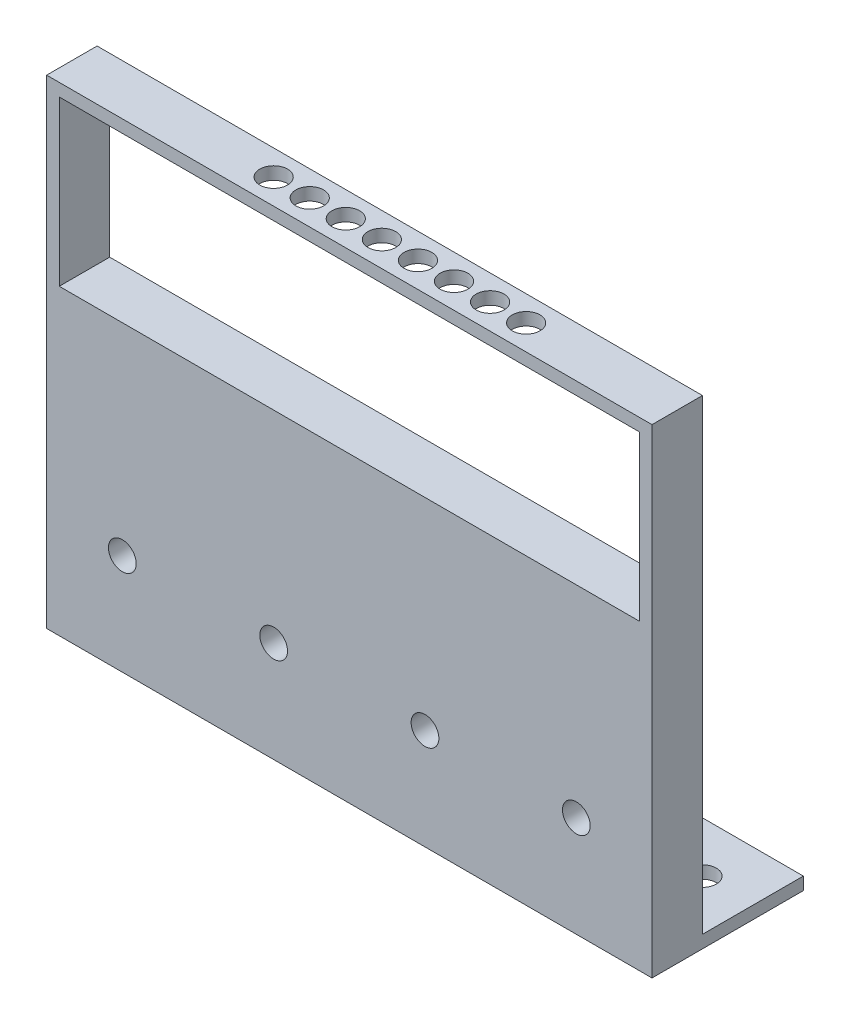
from build123d import *

# Parameters (mm, degrees)
SKETCH1_W               = 152.4
SKETCH1_H               = 12.7
BOSS_EXTRUDE1_DEPTH     = 76.2
SKETCH2_R               = 3.4925
BOSS_EXTRUDE4_DEPTH     = 3.175
BOSS_EXTRUDE5_DEPTH     = 12.7
CUT_EXTRUDE1_REACH      = 148.188
SKETCH4_R               = 3.4925
CUT_EXTRUDE2_DEPTH      = 147.187978302
CUT_EXTRUDE2_DEPTH_BACK = 147.187978302
SKETCH5_R               = 3.4925


with BuildPart() as part:
    # Sketch1 → Boss-Extrude1 (new body)
    with BuildSketch(Plane(origin=(0, 0, 0), x_dir=(1, 0, 0), z_dir=(0, 1, 0))):
        Rectangle(SKETCH1_W, SKETCH1_H)
    extrude(amount=BOSS_EXTRUDE1_DEPTH)

    # Sketch2 → Boss-Extrude4 (add)
    with BuildSketch(Plane(origin=(0, 0, 0), x_dir=(1, 0, 0), z_dir=(0, 1, 0))):
        Polygon((-76.2, 19.05), (-76.2, 6.35), (76.2, 6.35), (76.2, 31.75), (-76.2, 31.75), align=None)
        with Locations(Location((-63.5, 19.05, 0), (0, 0, 270))):
            Circle(SKETCH2_R, mode=Mode.SUBTRACT)
        with Locations(Location((-38.1, 19.05, 0), (0, 0, 270))):
            Circle(SKETCH2_R, mode=Mode.SUBTRACT)
        with Locations(Location((-12.7, 19.05, 0), (0, 0, 270))):
            Circle(SKETCH2_R, mode=Mode.SUBTRACT)
        with Locations(Location((12.7, 19.05, 0), (0, 0, 270))):
            Circle(SKETCH2_R, mode=Mode.SUBTRACT)
        with Locations(Location((38.1, 19.05, 0), (0, 0, 270))):
            Circle(SKETCH2_R, mode=Mode.SUBTRACT)
        with Locations(Location((63.5, 19.05, 0), (0, 0, 270))):
            Circle(SKETCH2_R, mode=Mode.SUBTRACT)
    extrude(amount=BOSS_EXTRUDE4_DEPTH)

    # Sketch3 → Boss-Extrude5 (add)
    with BuildSketch(Plane.XY.offset(6.35)):
        Polygon((-76.2, 76.2), (-76.2, 120.65), (76.2, 120.65), (76.2, 76.2), (73.025, 76.2), (73.025, 117.475), (-73.025, 117.475), (-73.025, 76.2), align=None)
    extrude(amount=-BOSS_EXTRUDE5_DEPTH)

    # Sketch4 → Cut-Extrude1 (cut, up to next)
    with BuildSketch(Plane(origin=(0, 120.65, 0), x_dir=(1, 0, 0), z_dir=(0, 1, 0)), mode=Mode.PRIVATE) as cut_extrude1_sk1:
        with Locations(Location((-25.4, 0, 0), (0, 0, 270))):
            Circle(SKETCH4_R)
    cut_extrude1_tool1 = extrude(cut_extrude1_sk1.sketch, amount=-CUT_EXTRUDE1_REACH, mode=Mode.PRIVATE) & part.part
    # Sketch4 → Cut-Extrude1 (cut, up to next)
    with BuildSketch(Plane(origin=(0, 120.65, 0), x_dir=(1, 0, 0), z_dir=(0, 1, 0)), mode=Mode.PRIVATE) as cut_extrude1_sk2:
        with Locations(Location((-16.3195, 0, 0), (0, 0, 270))):
            Circle(SKETCH4_R)
    cut_extrude1_tool2 = extrude(cut_extrude1_sk2.sketch, amount=-CUT_EXTRUDE1_REACH, mode=Mode.PRIVATE) & part.part
    # Sketch4 → Cut-Extrude1 (cut, up to next)
    with BuildSketch(Plane(origin=(0, 120.65, 0), x_dir=(1, 0, 0), z_dir=(0, 1, 0)), mode=Mode.PRIVATE) as cut_extrude1_sk3:
        with Locations(Location((-7.239, 0, 0), (0, 0, 270))):
            Circle(SKETCH4_R)
    cut_extrude1_tool3 = extrude(cut_extrude1_sk3.sketch, amount=-CUT_EXTRUDE1_REACH, mode=Mode.PRIVATE) & part.part
    # Sketch4 → Cut-Extrude1 (cut, up to next)
    with BuildSketch(Plane(origin=(0, 120.65, 0), x_dir=(1, 0, 0), z_dir=(0, 1, 0)), mode=Mode.PRIVATE) as cut_extrude1_sk4:
        with Locations(Location((1.8415, 0, 0), (0, 0, 270))):
            Circle(SKETCH4_R)
    cut_extrude1_tool4 = extrude(cut_extrude1_sk4.sketch, amount=-CUT_EXTRUDE1_REACH, mode=Mode.PRIVATE) & part.part
    # Sketch4 → Cut-Extrude1 (cut, up to next)
    with BuildSketch(Plane(origin=(0, 120.65, 0), x_dir=(1, 0, 0), z_dir=(0, 1, 0)), mode=Mode.PRIVATE) as cut_extrude1_sk5:
        with Locations(Location((10.922, 0, 0), (0, 0, 270))):
            Circle(SKETCH4_R)
    cut_extrude1_tool5 = extrude(cut_extrude1_sk5.sketch, amount=-CUT_EXTRUDE1_REACH, mode=Mode.PRIVATE) & part.part
    # Sketch4 → Cut-Extrude1 (cut, up to next)
    with BuildSketch(Plane(origin=(0, 120.65, 0), x_dir=(1, 0, 0), z_dir=(0, 1, 0)), mode=Mode.PRIVATE) as cut_extrude1_sk6:
        with Locations(Location((20.0025, 0, 0), (0, 0, 270))):
            Circle(SKETCH4_R)
    cut_extrude1_tool6 = extrude(cut_extrude1_sk6.sketch, amount=-CUT_EXTRUDE1_REACH, mode=Mode.PRIVATE) & part.part
    # Sketch4 → Cut-Extrude1 (cut, up to next)
    with BuildSketch(Plane(origin=(0, 120.65, 0), x_dir=(1, 0, 0), z_dir=(0, 1, 0)), mode=Mode.PRIVATE) as cut_extrude1_sk7:
        with Locations(Location((29.083, 0, 0), (0, 0, 270))):
            Circle(SKETCH4_R)
    cut_extrude1_tool7 = extrude(cut_extrude1_sk7.sketch, amount=-CUT_EXTRUDE1_REACH, mode=Mode.PRIVATE) & part.part
    # Sketch4 → Cut-Extrude1 (cut, up to next)
    with BuildSketch(Plane(origin=(0, 120.65, 0), x_dir=(1, 0, 0), z_dir=(0, 1, 0)), mode=Mode.PRIVATE) as cut_extrude1_sk8:
        with Locations(Location((38.1635, 0, 0), (0, 0, 270))):
            Circle(SKETCH4_R)
    cut_extrude1_tool8 = extrude(cut_extrude1_sk8.sketch, amount=-CUT_EXTRUDE1_REACH, mode=Mode.PRIVATE) & part.part
    add(cut_extrude1_tool1.solids().sort_by_distance((-25.4, 120.65, 0))[0], mode=Mode.SUBTRACT)
    add(cut_extrude1_tool2.solids().sort_by_distance((-16.3195, 120.65, 0))[0], mode=Mode.SUBTRACT)
    add(cut_extrude1_tool3.solids().sort_by_distance((-7.239, 120.65, 0))[0], mode=Mode.SUBTRACT)
    add(cut_extrude1_tool4.solids().sort_by_distance((1.8415, 120.65, 0))[0], mode=Mode.SUBTRACT)
    add(cut_extrude1_tool5.solids().sort_by_distance((10.922, 120.65, 0))[0], mode=Mode.SUBTRACT)
    add(cut_extrude1_tool6.solids().sort_by_distance((20.0025, 120.65, 0))[0], mode=Mode.SUBTRACT)
    add(cut_extrude1_tool7.solids().sort_by_distance((29.083, 120.65, 0))[0], mode=Mode.SUBTRACT)
    add(cut_extrude1_tool8.solids().sort_by_distance((38.1635, 120.65, 0))[0], mode=Mode.SUBTRACT)

    # Sketch5 → Cut-Extrude2 (cut, two sides: drawn at the far end of the back side and taken through both)
    with BuildSketch(Plane.XY.offset(-CUT_EXTRUDE2_DEPTH_BACK)):
        with Locations((-57.15, 25.4)):
            Circle(SKETCH5_R)
        with Locations((-19.05, 25.4)):
            Circle(SKETCH5_R)
        with Locations((19.05, 25.4)):
            Circle(SKETCH5_R)
        with Locations((57.15, 25.4)):
            Circle(SKETCH5_R)
    extrude(amount=CUT_EXTRUDE2_DEPTH + CUT_EXTRUDE2_DEPTH_BACK, mode=Mode.SUBTRACT)


solid = part.part
